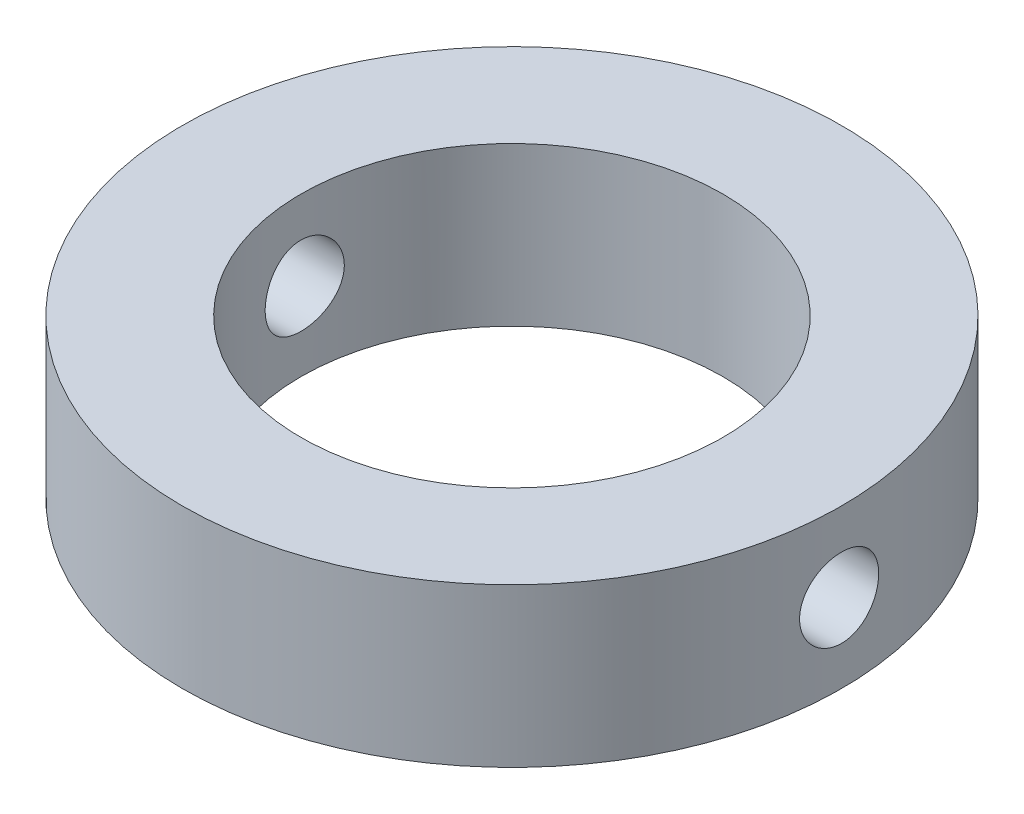
from build123d import *

# Parameters (mm, degrees)
SKETCH2_R               = 25
BOSS_EXTRUDE1_DEPTH     = 12
CUT_EXTRUDE1_DEPTH      = 38.336309405
CUT_EXTRUDE1_DEPTH_BACK = 38.336309405
SKETCH3_R               = 3
CUT_EXTRUDE2_DEPTH      = 38.33630958
CUT_EXTRUDE2_DEPTH_BACK = 38.33630958
SKETCH4_R               = 16


with BuildPart() as part:
    # Sketch2 → Boss-Extrude1 (new body)
    with BuildSketch(Plane(origin=(0, 0, 0), x_dir=(1, 0, 0), z_dir=(0, 1, 0))):
        with Locations(Location((0, 0, 0), (0, 0, 270))):
            Circle(SKETCH2_R)
    extrude(amount=BOSS_EXTRUDE1_DEPTH)

    # Sketch3 → Cut-Extrude1 (cut, two sides: drawn at the far end of the back side and taken through both)
    with BuildSketch(Plane(origin=(0, 0, 0), x_dir=(0, 0, -1), z_dir=(1, 0, 0)).offset(-CUT_EXTRUDE1_DEPTH_BACK)):
        with Locations((0, 5.972869538)):
            Circle(SKETCH3_R)
    extrude(amount=CUT_EXTRUDE1_DEPTH + CUT_EXTRUDE1_DEPTH_BACK, mode=Mode.SUBTRACT)

    # Sketch4 → Cut-Extrude2 (cut, two sides: drawn at the far end of the back side and taken through both)
    with BuildSketch(Plane.XZ.offset(-CUT_EXTRUDE2_DEPTH_BACK)):
        with Locations(Location((0, 0, 0), (0, 0, 270))):
            Circle(SKETCH4_R)
    extrude(amount=CUT_EXTRUDE2_DEPTH + CUT_EXTRUDE2_DEPTH_BACK, mode=Mode.SUBTRACT)


solid = part.part
